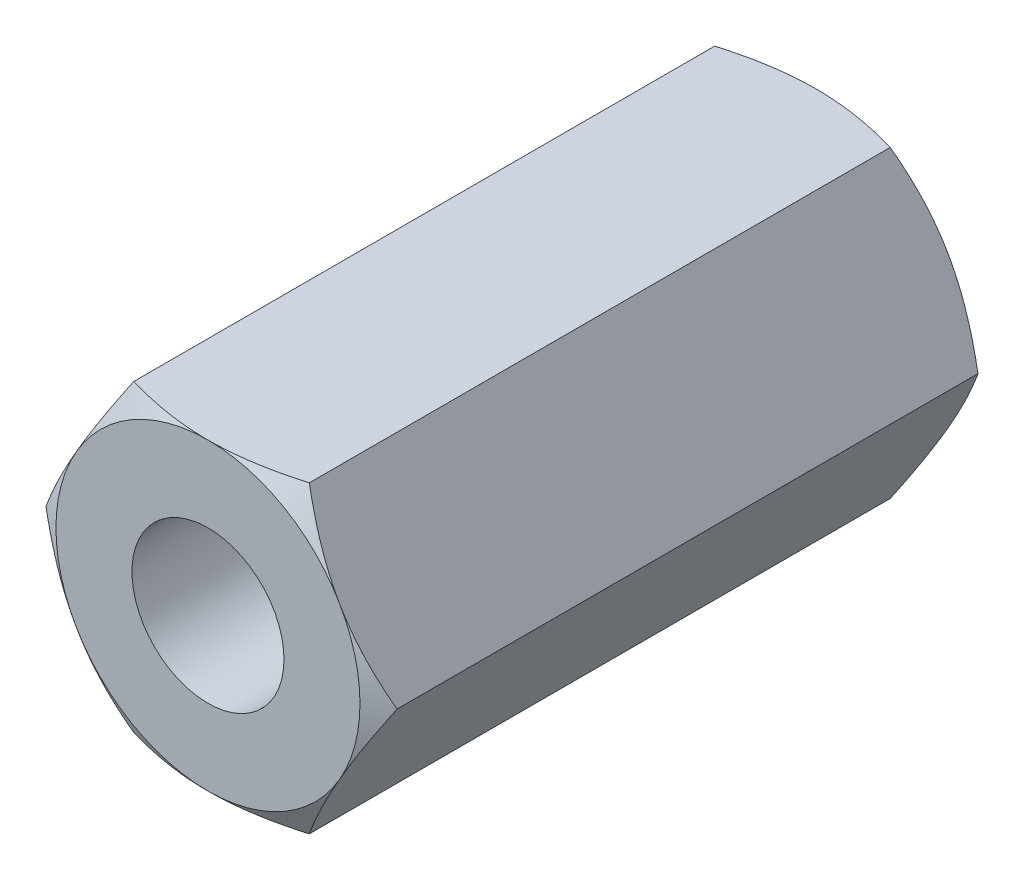
from build123d import *

# Parameters (mm, degrees)
SKETCH2_OUTSIDE_W               = 12.704
SKETCH2_OUTSIDE_H               = 12.704
CUT_EXTRUDE1_DEPTH              = 14.119641763
M3X0_5_TAPPED_HOLE1_D           = 2.5
M3X0_5_TAPPED_HOLE1_DEPTH       = 11
M3X0_5_TAPPED_HOLE1_CBORE_D     = 3
M3X0_5_TAPPED_HOLE1_CBORE_DEPTH = 10
M3X0_5_TAPPED_HOLE1_TIP         = 0.751075774
M3X0_5_TAPPED_HOLE2_D           = 2.5
M3X0_5_TAPPED_HOLE2_DEPTH       = 7.3
M3X0_5_TAPPED_HOLE2_CBORE_D     = 3
M3X0_5_TAPPED_HOLE2_CBORE_DEPTH = 6.3
M3X0_5_TAPPED_HOLE2_TIP         = 0.751075774


with BuildPart() as part:
    # Sketch1 → Revolve1 (revolve)
    with BuildSketch(Plane(origin=(0, 0, 0), x_dir=(0, 0, -1), z_dir=(1, 0, 0))):
        Polygon((-6, 0), (-6, 3), (-5.566987298, 3.75), (5.566987298, 3.75), (6, 3), (6, 0), align=None)
    revolve(axis=Axis((0, 0, 5.584882278), (0, 0, -1)))

    # Sketch2 outside → Cut-Extrude1 (cut, through all)
    with BuildSketch(Plane.XY.offset(6)):
        Rectangle(SKETCH2_OUTSIDE_W, SKETCH2_OUTSIDE_H)
        Polygon((1.732050808, -3), (3.464101615, 0), (1.732050808, 3), (-1.732050808, 3), (-3.464101615, 0), (-1.732050808, -3), align=None, mode=Mode.SUBTRACT)
    extrude(amount=-CUT_EXTRUDE1_DEPTH, mode=Mode.SUBTRACT)

    # M3x0.5 Tapped Hole1
    with Locations(Plane.XY.offset(6)):
        with Locations((0, 0)):
            CounterBoreHole(M3X0_5_TAPPED_HOLE1_D / 2, M3X0_5_TAPPED_HOLE1_CBORE_D / 2, M3X0_5_TAPPED_HOLE1_CBORE_DEPTH, depth=M3X0_5_TAPPED_HOLE1_DEPTH)
            with Locations((0, 0, -(M3X0_5_TAPPED_HOLE1_DEPTH + M3X0_5_TAPPED_HOLE1_TIP / 2))):  # 118° drill point
                Cone(0, M3X0_5_TAPPED_HOLE1_D / 2, M3X0_5_TAPPED_HOLE1_TIP, mode=Mode.SUBTRACT)

    # M3x0.5 Tapped Hole2
    with Locations(Plane(origin=(0, 0, -6), x_dir=(-1, 0, 0), z_dir=(0, 0, -1))):
        with Locations((0, 0)):
            CounterBoreHole(M3X0_5_TAPPED_HOLE2_D / 2, M3X0_5_TAPPED_HOLE2_CBORE_D / 2, M3X0_5_TAPPED_HOLE2_CBORE_DEPTH, depth=M3X0_5_TAPPED_HOLE2_DEPTH)
            with Locations((0, 0, -(M3X0_5_TAPPED_HOLE2_DEPTH + M3X0_5_TAPPED_HOLE2_TIP / 2))):  # 118° drill point
                Cone(0, M3X0_5_TAPPED_HOLE2_D / 2, M3X0_5_TAPPED_HOLE2_TIP, mode=Mode.SUBTRACT)


solid = part.part
